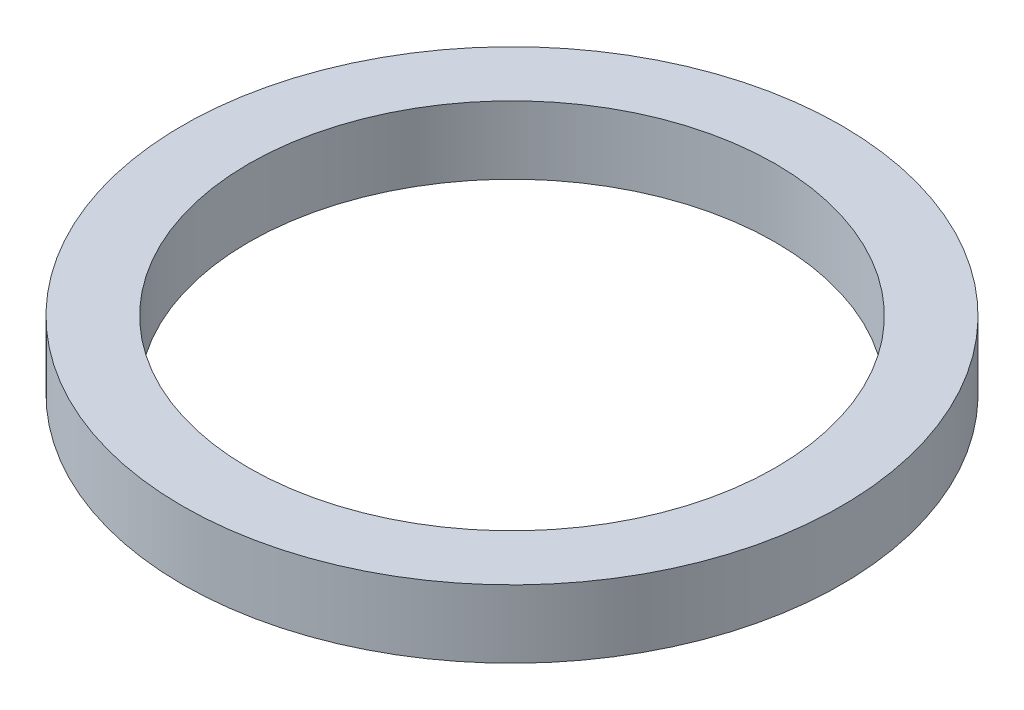
from build123d import *

# Parameters (mm, degrees)
SKETCH1_R           = 12.7
SKETCH1_R_2         = 10.1473
BOSS_EXTRUDE1_DEPTH = 2.6162


with BuildPart() as part:
    # Sketch1 → Boss-Extrude1 (new body)
    with BuildSketch(Plane(origin=(0, 0, 0), x_dir=(1, 0, 0), z_dir=(0, 1, 0))):
        with Locations(Location((0, 0, 0), (0, 0, 270))):
            Circle(SKETCH1_R)
        with Locations(Location((0, 0, 0), (0, 0, 270))):
            Circle(SKETCH1_R_2, mode=Mode.SUBTRACT)
    extrude(amount=BOSS_EXTRUDE1_DEPTH)


solid = part.part
